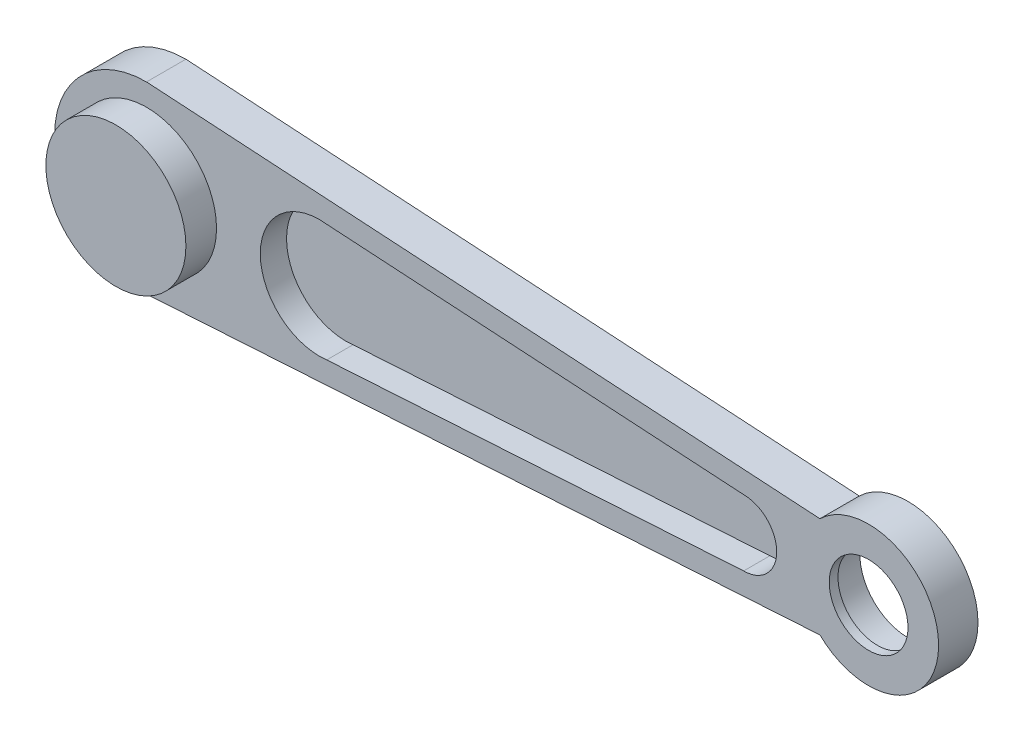
from build123d import *
from build123d.topology import SkipClean

# Parameters (mm, degrees)
SKETCH6_R           = 9
BOSS_EXTRUDE2_DEPTH = 9
SKETCH6_10_R        = 16
BOSS_EXTRUDE3_DEPTH = 16
CUT_EXTRUDE2_REACH  = 187.915
CUT_EXTRUDE2_START  = 3
SKETCH6_20_R        = 11
CUT_EXTRUDE5_DEPTH  = 7


with BuildPart() as part:
    # Sketch6 → Boss-Extrude2 (new body)
    with BuildSketch(Plane.XY):
        with BuildLine():
            Line((0, -21), (153.875702269, -11.5))
            ThreePointArc((153.875702269, -11.5), (181, 0), (153.875702269, 11.5))
            Line((153.875702269, 11.5), (0, 21))
            ThreePointArc((0, 21), (-21, 0), (0, -21))
        make_face()
        with Locations((165, 0)):
            Circle(SKETCH6_R, mode=Mode.SUBTRACT)
        with BuildLine():
            ThreePointArc((41.185040199, -13.422236438), (40.356373264, -13.49895246), (39.524556783, -13.524556783))
            Line((39.524556783, -13.524556783), (41.185040199, -13.422236438))
        make_face(mode=Mode.SUBTRACT)
        with BuildLine():
            ThreePointArc((39.524556783, 13.524556783), (40.356373264, 13.49895246), (41.185040199, 13.422236438))
            Line((41.185040199, 13.422236438), (39.524556783, 13.524556783))
        make_face(mode=Mode.SUBTRACT)
    extrude(amount=BOSS_EXTRUDE2_DEPTH)

    # Sketch6<10> → Boss-Extrude3 (add)
    with BuildSketch(Plane.XY):
        Circle(SKETCH6_10_R)
    extrude(amount=BOSS_EXTRUDE3_DEPTH)

    # Sketch6<13> → Cut-Extrude2 (cut, up to next)
    with BuildSketch(Plane.XY.offset(CUT_EXTRUDE2_START), mode=Mode.PRIVATE) as cut_extrude2_sk1:
        with BuildLine():
            ThreePointArc((39.524556783, 13.524556783), (29.961250969, 9.563305814), (26, 0))
            Line((26, 0), (144, 0))
            ThreePointArc((144, 0), (141.788053239, 5.34011187), (136.447941368, 7.552058632))
            Line((136.447941368, 7.552058632), (41.185040199, 13.422236438))
            Line((41.185040199, 13.422236438), (39.524556783, 13.524556783))
        make_face()
    cut_extrude2_tool1 = extrude(cut_extrude2_sk1.sketch, amount=CUT_EXTRUDE2_REACH, mode=Mode.PRIVATE) & part.part
    # Sketch6<13> → Cut-Extrude2 (cut, up to next)
    with BuildSketch(Plane.XY.offset(CUT_EXTRUDE2_START), mode=Mode.PRIVATE) as cut_extrude2_sk2:
        with BuildLine():
            Line((144, 0), (26, 0))
            ThreePointArc((26, 0), (29.961250969, -9.563305814), (39.524556783, -13.524556783))
            Line((39.524556783, -13.524556783), (41.185040199, -13.422236438))
            Line((41.185040199, -13.422236438), (136.447941368, -7.552058632))
            ThreePointArc((136.447941368, -7.552058632), (141.788053239, -5.34011187), (144, 0))
        make_face()
    cut_extrude2_tool2 = extrude(cut_extrude2_sk2.sketch, amount=CUT_EXTRUDE2_REACH, mode=Mode.PRIVATE) & part.part
    add(cut_extrude2_tool1.solids().sort_by_distance((79.598695, 5.367714, 3))[0], mode=Mode.SUBTRACT)
    add(cut_extrude2_tool2.solids().sort_by_distance((79.598695, -5.367714, 3))[0], mode=Mode.SUBTRACT)

    # Sketch6<20> → Cut-Extrude5 (cut)
    with SkipClean():  # the faces are left unmerged after this step: merging them gives an invalid solid
        with BuildSketch(Plane.XY):
            with Locations((165, 0)):
                Circle(SKETCH6_20_R)
        extrude(amount=CUT_EXTRUDE5_DEPTH, mode=Mode.SUBTRACT)


solid = part.part
